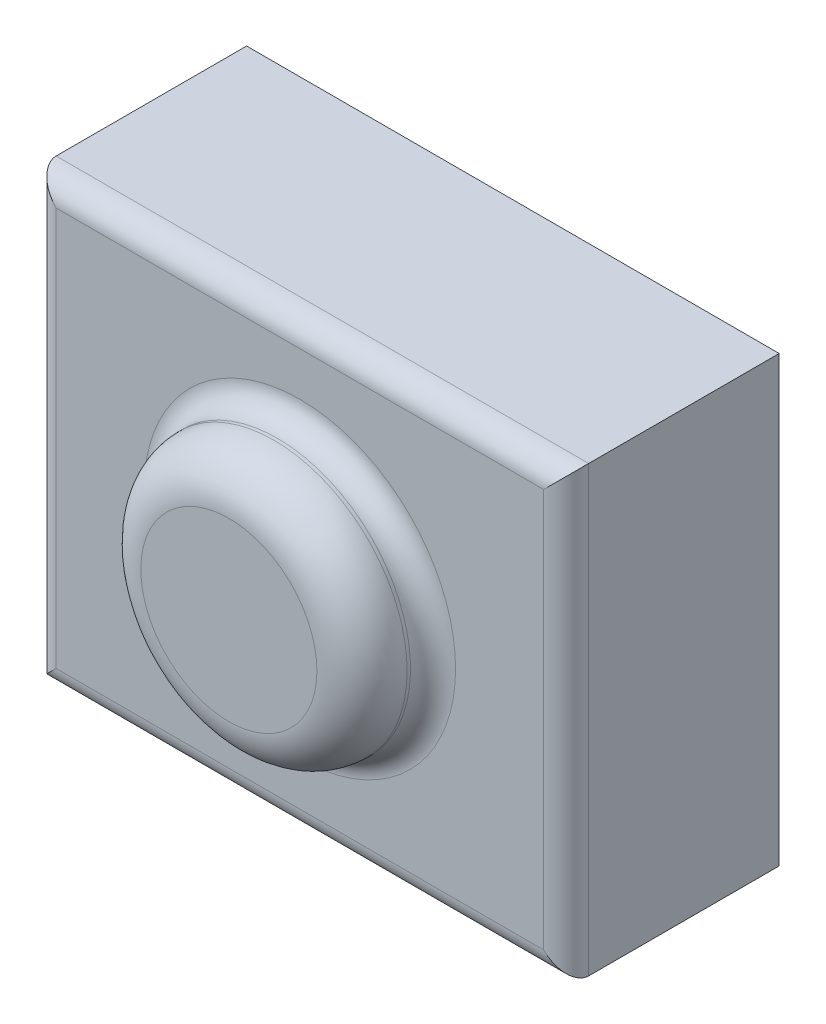
from build123d import *

# Parameters (mm, degrees)
SKETCH1_W           = 3
SKETCH1_H           = 2.5
BOSS_EXTRUDE1_DEPTH = 1.2
SKETCH2_R           = 0.75
BOSS_EXTRUDE2_DEPTH = 0.4
FILLET1_R           = 0.254
FILLET2_R           = 0.127


with BuildPart() as part:
    # Sketch1 → Boss-Extrude1 (new body)
    with BuildSketch(Plane.XY):
        Rectangle(SKETCH1_W, SKETCH1_H)
    extrude(amount=BOSS_EXTRUDE1_DEPTH)

    # Sketch2 → Boss-Extrude2 (add)
    with BuildSketch(Plane.XY.offset(1.2)):
        with Locations(Location((0, 0, 0), (0, 0, 180))):
            Circle(SKETCH2_R)
    extrude(amount=BOSS_EXTRUDE2_DEPTH)

    # Fillet1
    fillet1_edges = [part.edges().sort_by_distance(p)[0] for p in [
        (0.75, 0, 1.6),
    ]]
    fillet(fillet1_edges, radius=FILLET1_R)

    # Fillet2
    fillet2_edges = [part.edges().sort_by_distance(p)[0] for p in [
        (-1.5, 0, 1.2),
        (0, -1.25, 1.2),
        (0.75, 0, 1.2),
        (1.5, 0, 1.2),
        (0, 1.25, 1.2),
    ]]
    fillet(fillet2_edges, radius=FILLET2_R)


solid = part.part
